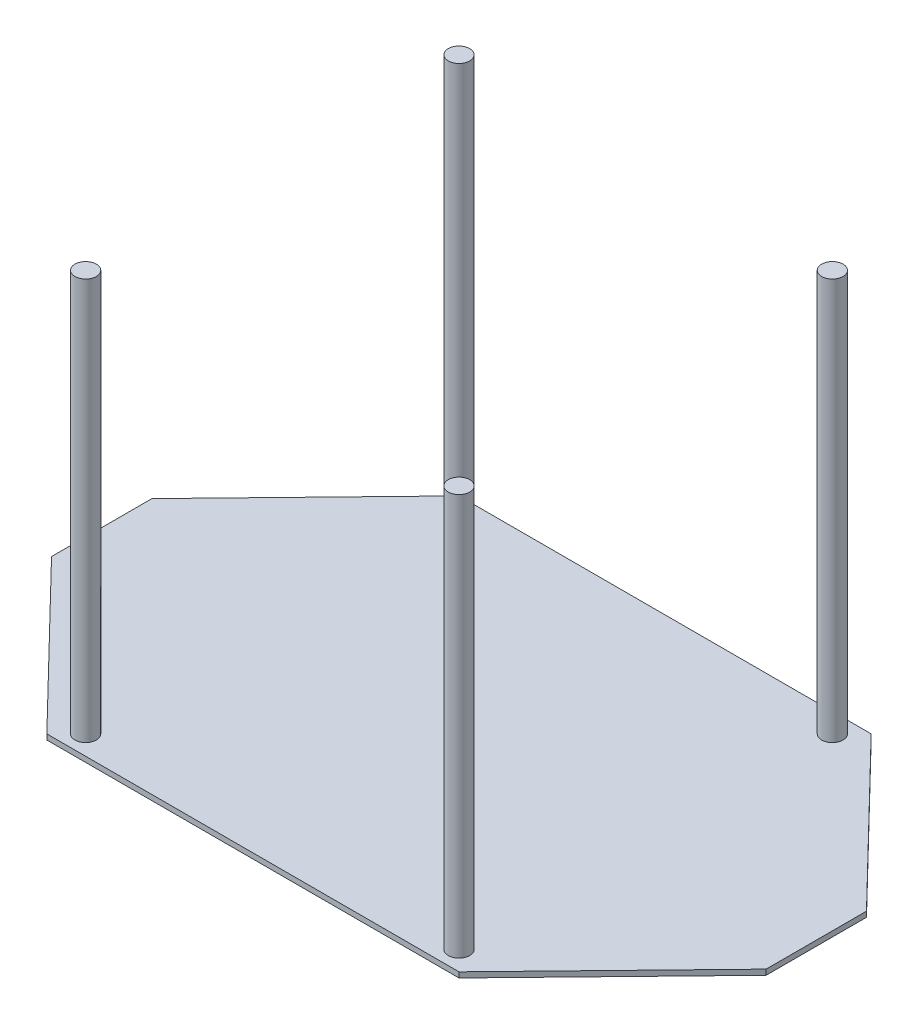
from build123d import *

# Parameters (mm, degrees)
EXTRUDE_2_DEPTH = 4
SKETCH_2_R      = 8
EXTRUDE_3_DEPTH = 300


with BuildPart() as part:
    # Эскиз1 → Бобышка-Вытянуть2 (new body)
    with BuildSketch(Plane(origin=(0, 0, 0), x_dir=(1, 0, 0), z_dir=(0, 1, 0))):
        Polygon((154, -154), (-154, -154), (-267, -37.5), (-267, 37.5), (-154, 154), (154, 154), (267, 37.5), (267, -37.5), align=None)
    extrude(amount=-EXTRUDE_2_DEPTH)

    # Эскиз2 → Бобышка-Вытянуть3 (add)
    with BuildSketch(Plane(origin=(0, 0, 0), x_dir=(1, 0, 0), z_dir=(0, 1, 0))):
        with Locations(Location((-139.5, 139.5, 0), (0, 0, 270))):
            Circle(SKETCH_2_R)
        with Locations(Location((139.5, 139.5, 0), (0, 0, 90))):
            Circle(SKETCH_2_R)
        with Locations(Location((139.5, -139.5, 0), (0, 0, 270))):
            Circle(SKETCH_2_R)
        with Locations(Location((-139.5, -139.5, 0), (0, 0, 90))):
            Circle(SKETCH_2_R)
    extrude(amount=EXTRUDE_3_DEPTH)


solid = part.part
